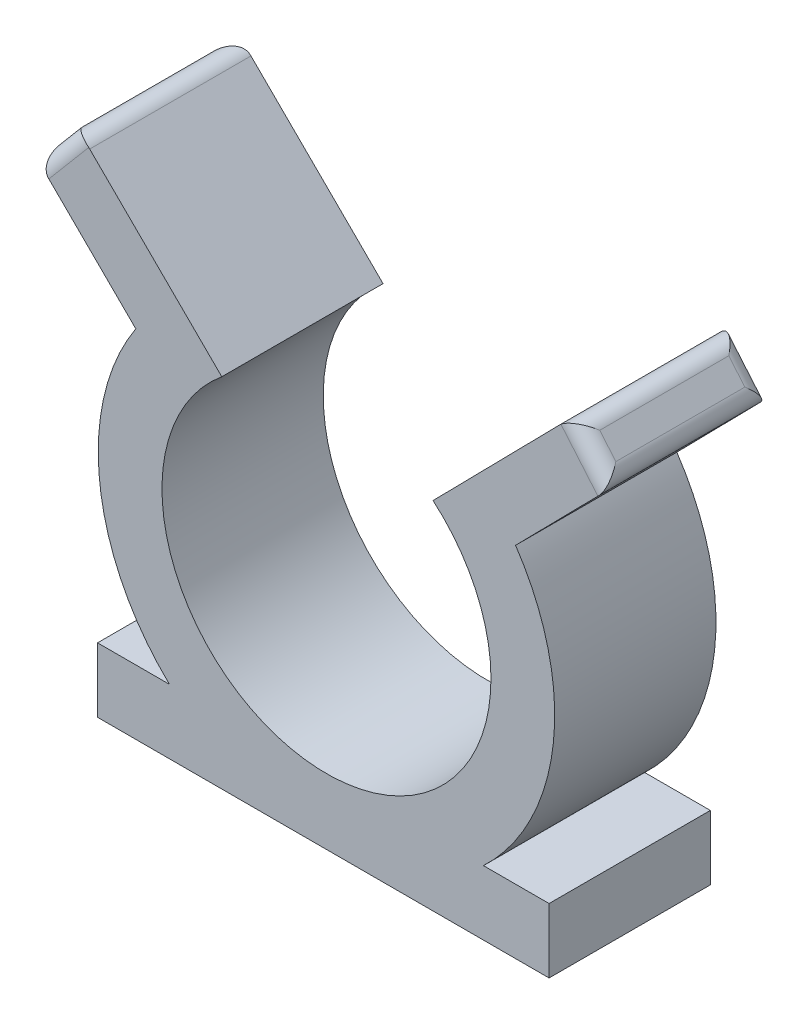
from build123d import *

# Parameters (mm, degrees)
SKETCH1_W           = 28
SKETCH1_H           = 10
BOSS_EXTRUDE1_DEPTH = 4
BOSS_EXTRUDE2_START = -5
BOSS_EXTRUDE2_DEPTH = 10
FILLET3_R           = 1


with BuildPart() as part:
    # Sketch1 → Boss-Extrude1 (new body)
    with BuildSketch(Plane(origin=(0, 0, 0), x_dir=(1, 0, 0), z_dir=(0, 1, 0))):
        Rectangle(SKETCH1_W, SKETCH1_H)
    extrude(amount=BOSS_EXTRUDE1_DEPTH)

    # Sketch3 → Boss-Extrude2 (add)
    with BuildSketch(Plane.XY.offset(BOSS_EXTRUDE2_START)):
        with BuildLine():
            Line((6.804916492, 22.043099096), (15.434965947, 30.824064473))
            Line((15.434965947, 30.824064473), (17.72994071, 28.10787731))
            Line((17.72994071, 28.10787731), (11.921630408, 22.197995574))
            ThreePointArc((11.921630408, 22.197995574), (0.285107603, 0.121770207), (-11.627623737, 22.050181492))
            Line((-11.627623737, 22.050181492), (-17.72994071, 28.10787731))
            Line((-17.72994071, 28.10787731), (-15.255675803, 31.036260962))
            Line((-15.255675803, 31.036260962), (-6.295168075, 22.141273955))
            ThreePointArc((-6.295168075, 22.141273955), (0.119840794, 4.073834753), (6.804916492, 22.043099096))
        make_face()
    extrude(amount=BOSS_EXTRUDE2_DEPTH)

    # Fillet3
    fillet3_edges = [part.edges().sort_by_distance(p)[0] for p in [
        (16.582453328, 29.465970891, -5),
        (17.72994071, 28.10787731, 0),
        (15.434965947, 30.824064473, 0),
        (-16.492808256, 29.572069136, -5),
        (-15.255675803, 31.036260962, 0),
        (-17.72994071, 28.10787731, 0),
        (16.582453328, 29.465970891, 5),
        (-16.492808256, 29.572069136, 5),
    ]]
    fillet(fillet3_edges, radius=FILLET3_R)


solid = part.part
